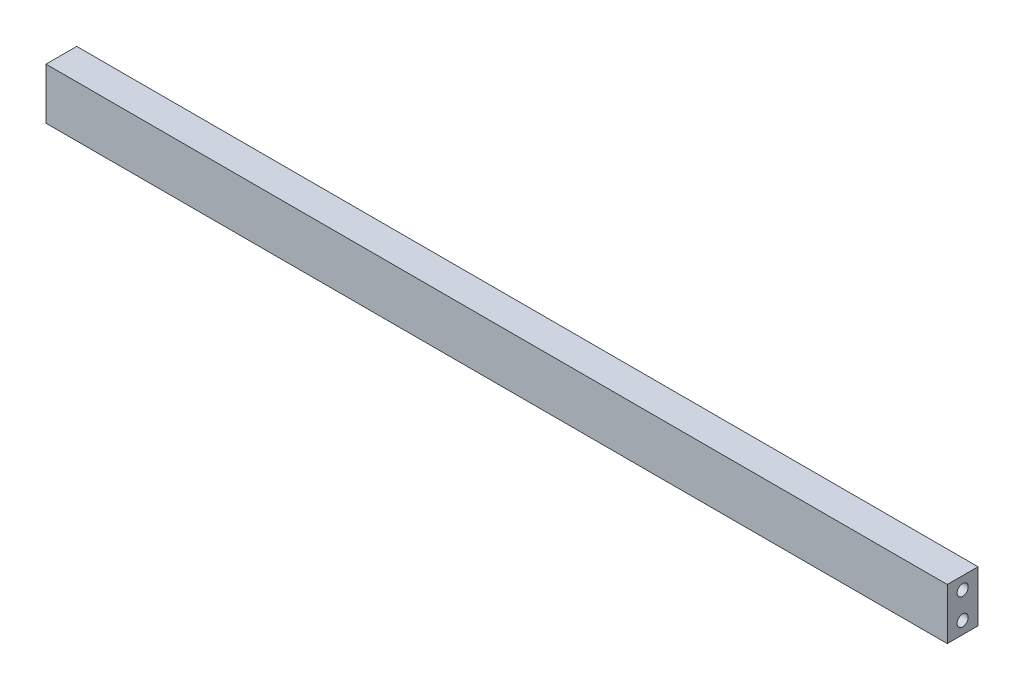
from build123d import *

# Parameters (mm, degrees)
SKETCH1_W                          = 9.525
SKETCH1_H                          = 15.875
BOSS_EXTRUDE1_DEPTH                = 139.7
TAP_DRILL_FOR_8_32_TAP1_AT_2_COUNT = 2
TAP_DRILL_FOR_8_32_TAP1_AT_2_PITCH = 8.1788


with BuildPart() as part:
    # Sketch1 → Boss-Extrude1 (new, symmetric)
    with BuildSketch(Plane(origin=(0, 0, 0), x_dir=(0, 0, -1), z_dir=(1, 0, 0))):
        Rectangle(SKETCH1_W, SKETCH1_H)
    extrude(amount=BOSS_EXTRUDE1_DEPTH, both=True)

    # Sketch4 → Tap Drill for #8-32 Tap1 (revolve, cut)
    with BuildSketch(Plane(origin=(139.7, 4.0894, 0), x_dir=(0, 0, -1), z_dir=(0, 1, 0))):
        Polygon((0, 0), (0, 11.197806461), (1.7272, 10.16), (1.7272, 0), align=None)
    tap_drill_for_8_32_tap1 = revolve(axis=Axis((146.05, 4.0894, 0), (-1, 0, 0)), mode=Mode.SUBTRACT)

    # Tap Drill for #8-32 Tap1 at 2: Tap Drill for #8-32 Tap1 ×2
    with Locations(*[(0, -i * TAP_DRILL_FOR_8_32_TAP1_AT_2_PITCH, 0) for i in range(1, TAP_DRILL_FOR_8_32_TAP1_AT_2_COUNT)]):
        add(tap_drill_for_8_32_tap1, mode=Mode.SUBTRACT)

    # Mirror1: Tap Drill for #8-32 Tap1 across plane
    add(tap_drill_for_8_32_tap1.mirror(Plane(origin=(0, 0, 0), x_dir=(0, 0, 1), z_dir=(1, 0, 0))), mode=Mode.SUBTRACT)

    # Mirror1 copy 1 sketch → Mirror1 copy 1 (revolve, cut)
    with BuildSketch(Plane(origin=(-139.7, -4.0894, 0), x_dir=(0, 0, -1), z_dir=(0, 1, 0))):
        Polygon((0, 0), (0, -11.197806461), (1.7272, -10.16), (1.7272, 0), align=None)
    revolve(axis=Axis((-146.05, -4.0894, 0), (-1, 0, 0)), mode=Mode.SUBTRACT)


solid = part.part
